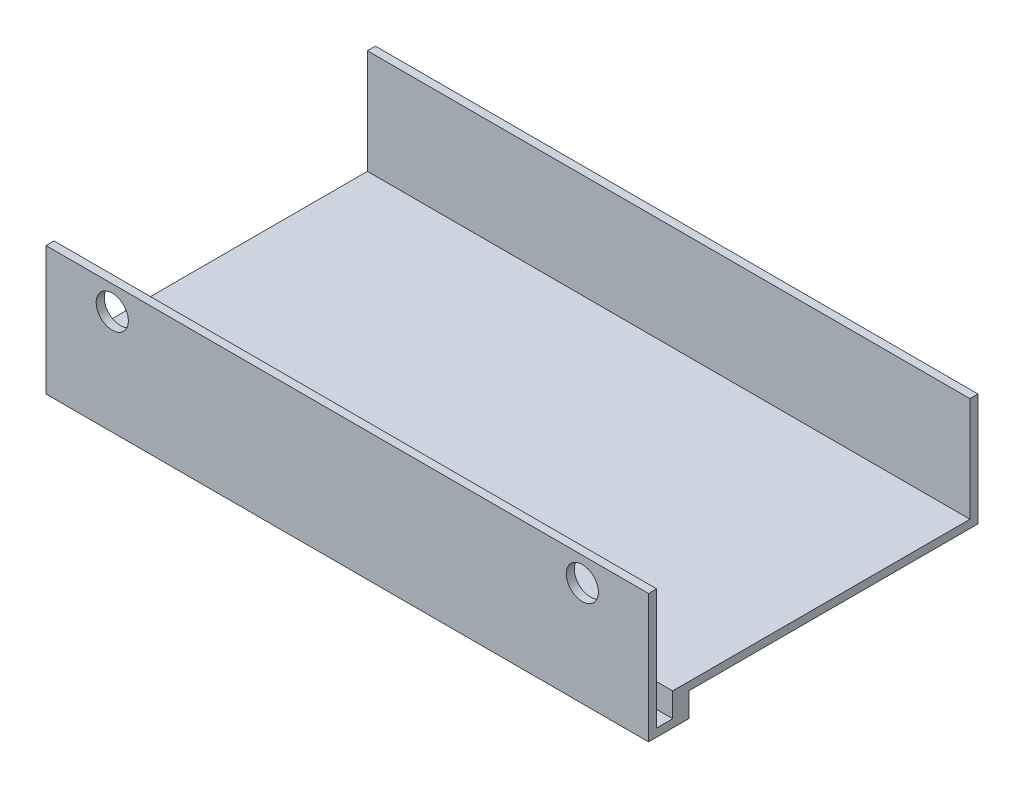
from build123d import *

# Parameters (mm, degrees)
ESQUISSE1_W             = 75
ESQUISSE1_H             = 16
ESQUISSE1_R             = 2
BOSS_EXTRU_1_DEPTH      = 1
ESQUISSE1_3_W           = 75
ESQUISSE1_3_H           = 1
BOSS_EXTRU_2_DEPTH      = 40
ESQUISSE2_W             = 75
ESQUISSE2_H             = 1
BOSS_EXTRU_3_DEPTH      = 16
ESQUISSE3_W             = 65
ESQUISSE3_H             = 33
ENL_V_MAT_EXTRU_1_DEPTH = 3
ESQUISSE4_W             = 75
ESQUISSE4_H             = 37
BOSS_EXTRU_4_DEPTH      = 3
ESQUISSE5_W             = 75
ESQUISSE5_H             = 36
ENL_V_MAT_EXTRU_2_DEPTH = 3


with BuildPart() as part:
    # Esquisse1 → Boss.-Extru.1 (new body)
    with BuildSketch(Plane.XY):
        with Locations((37.5, 7)):
            Rectangle(ESQUISSE1_W, ESQUISSE1_H)
        with Locations((8.25, 12)):
            Circle(ESQUISSE1_R, mode=Mode.SUBTRACT)
        with Locations((66.75, 12)):
            Circle(ESQUISSE1_R, mode=Mode.SUBTRACT)
    extrude(amount=BOSS_EXTRU_1_DEPTH)

    # Esquisse1<3> → Boss.-Extru.2 (add)
    with BuildSketch(Plane.XY):
        with Locations((37.5, -0.5)):
            Rectangle(ESQUISSE1_3_W, ESQUISSE1_3_H)
    extrude(amount=-BOSS_EXTRU_2_DEPTH)

    # Esquisse2 → Boss.-Extru.3 (add)
    with BuildSketch(Plane(origin=(0, 0, 0), x_dir=(1, 0, 0), z_dir=(0, 1, 0))):
        with Locations((37.5, 39.5)):
            Rectangle(ESQUISSE2_W, ESQUISSE2_H)
    extrude(amount=BOSS_EXTRU_3_DEPTH)

    # Esquisse3 → Enlèv. mat.-Extru.1 (cut)
    with BuildSketch(Plane.XZ.offset(1)):
        with Locations((37.5, -20.5)):
            Rectangle(ESQUISSE3_W, ESQUISSE3_H)
    extrude(amount=-ENL_V_MAT_EXTRU_1_DEPTH, mode=Mode.SUBTRACT)

    # Esquisse4 → Boss.-Extru.4 (add)
    with BuildSketch(Plane(origin=(0, 0, 0), x_dir=(1, 0, 0), z_dir=(0, 1, 0))):
        with Locations((37.5, 20.5)):
            Rectangle(ESQUISSE4_W, ESQUISSE4_H)
    extrude(amount=BOSS_EXTRU_4_DEPTH)

    # Esquisse5 → Enlèv. mat.-Extru.2 (cut)
    with BuildSketch(Plane.XZ.offset(1)):
        with Locations((37.5, -22)):
            Rectangle(ESQUISSE5_W, ESQUISSE5_H)
    extrude(amount=-ENL_V_MAT_EXTRU_2_DEPTH, mode=Mode.SUBTRACT)


solid = part.part
